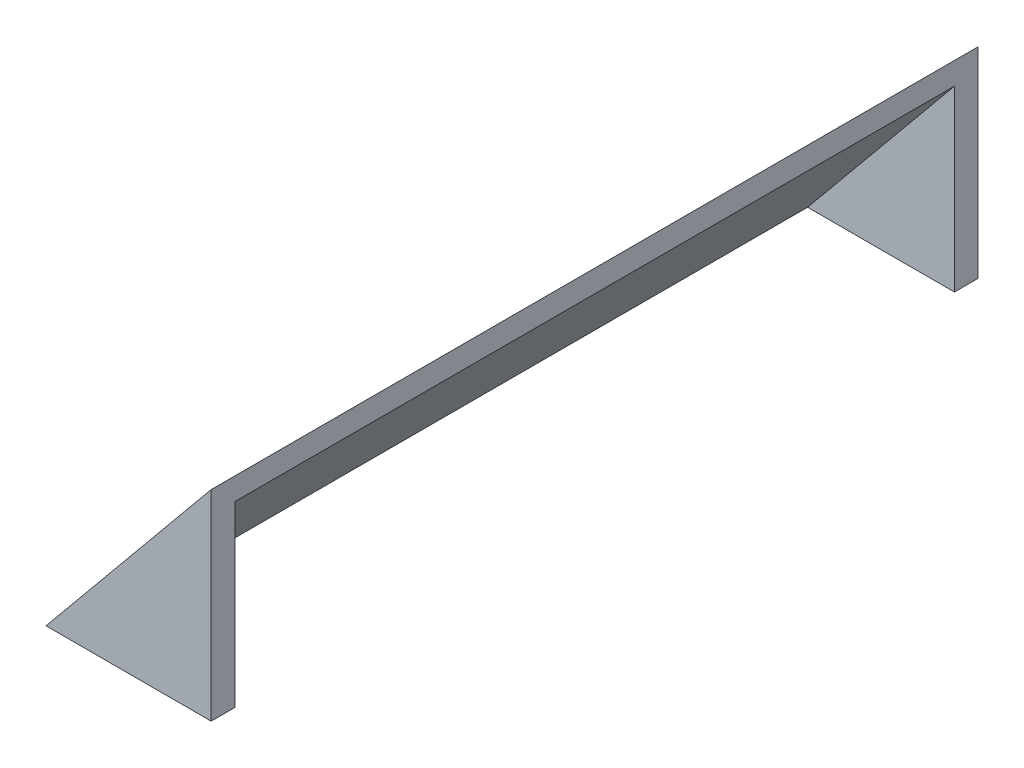
from build123d import *

# Parameters (mm, degrees)
BOSS_EXTRUDE2_DEPTH = 2
BOSS_EXTRUDE3_DEPTH = 61
BOSS_EXTRUDE4_DEPTH = 2


with BuildPart() as part:
    # Sketch1 → Boss-Extrude2 (new body)
    with BuildSketch(Plane.XY):
        Polygon((0, 0), (0, -17), (-14, -17), align=None)
    extrude(amount=BOSS_EXTRUDE2_DEPTH)

    # Sketch5 → Boss-Extrude3 (add)
    with BuildSketch(Plane.XY.offset(2)):
        Polygon((-14, -17), (-12.445455373, -17), (0, -1.887661332), (0, 0), align=None)
    extrude(amount=BOSS_EXTRUDE3_DEPTH)

    # Sketch6 → Boss-Extrude4 (add)
    with BuildSketch(Plane.XY.offset(63)):
        Polygon((0, 0), (0, -17), (-14, -17), align=None)
    extrude(amount=BOSS_EXTRUDE4_DEPTH)


solid = part.part
